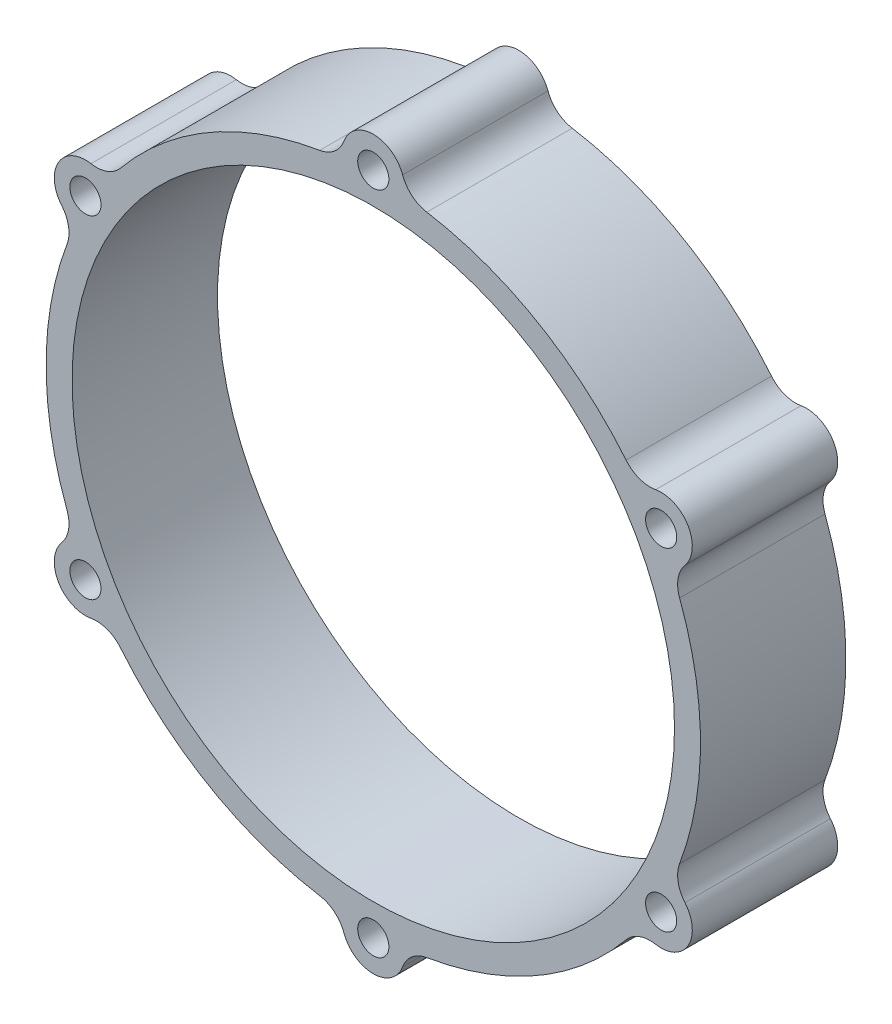
from build123d import *

# Parameters (mm, degrees)
SKETCH_1_R          = 31.5
SKETCH_1_R_2        = 29
EXTRUDE_1_DEPTH     = 14
EXTRUDE_START       = -14
EXTRUDE_2_DEPTH     = 14
SKETCH_3_R          = 1.5
CUT_EXTRUDE_1_DEPTH = 50.124840967
FILLET_1_R          = 3


with BuildPart() as part:
    # 草图1 → 凸台-拉伸1 (new body)
    with BuildSketch(Plane.XY):
        Circle(SKETCH_1_R)
        Circle(SKETCH_1_R_2, mode=Mode.SUBTRACT)
    extrude(amount=EXTRUDE_1_DEPTH)

    # 草图2 → 凸台-拉伸2 (add)
    with BuildSketch(Plane.XY.offset(14).offset(EXTRUDE_START)):
        with BuildLine():
            ThreePointArc((-28.627224802, 13.142754664), (-27.279800219, 15.75), (-25.695571815, 18.220526586))
            ThreePointArc((-25.695571815, 18.220526586), (-30.310889132, 17.5), (-28.627224802, 13.142754664))
        make_face()
        with BuildLine():
            ThreePointArc((-2.931652987, 31.36328125), (0, 31.5), (2.931652987, 31.36328125))
            ThreePointArc((2.931652987, 31.36328125), (0, 35), (-2.931652987, 31.36328125))
        make_face()
        with BuildLine():
            ThreePointArc((28.627224802, 13.142754664), (30.310889132, 17.5), (25.695571815, 18.220526586))
            ThreePointArc((25.695571815, 18.220526586), (27.279800219, 15.75), (28.627224802, 13.142754664))
        make_face()
        with BuildLine():
            ThreePointArc((25.695571815, -18.220526586), (30.310889132, -17.5), (28.627224802, -13.142754664))
            ThreePointArc((28.627224802, -13.142754664), (27.279800219, -15.75), (25.695571815, -18.220526586))
        make_face()
        with BuildLine():
            ThreePointArc((2.931652987, -31.36328125), (0, -31.5), (-2.931652987, -31.36328125))
            ThreePointArc((-2.931652987, -31.36328125), (0, -35), (2.931652987, -31.36328125))
        make_face()
        with BuildLine():
            ThreePointArc((-25.695571815, -18.220526586), (-27.279800219, -15.75), (-28.627224802, -13.142754664))
            ThreePointArc((-28.627224802, -13.142754664), (-30.310889132, -17.5), (-25.695571815, -18.220526586))
        make_face()
    extrude(amount=EXTRUDE_2_DEPTH)

    # 草图3 → 切除-拉伸1 (cut, through all)
    with BuildSketch(Plane.XY.offset(14)):
        with Locations((0, 32)):
            Circle(SKETCH_3_R)
        with Locations((-27.712812921, 16)):
            Circle(SKETCH_3_R)
        with Locations((-27.712812921, -16)):
            Circle(SKETCH_3_R)
        with Locations((0, -32)):
            Circle(SKETCH_3_R)
        with Locations((27.712812921, -16)):
            Circle(SKETCH_3_R)
        with Locations((27.712812921, 16)):
            Circle(SKETCH_3_R)
    extrude(amount=-CUT_EXTRUDE_1_DEPTH, mode=Mode.SUBTRACT)

    # 圆角1
    fillet_1_edges = [part.edges().sort_by_distance(p)[0] for p in [
        (-25.695571815, 18.220526586, 7),
        (-28.627224802, 13.142754664, 7),
        (2.931652987, 31.36328125, 7),
        (-2.931652987, 31.36328125, 7),
        (28.627224802, 13.142754664, 7),
        (25.695571815, 18.220526586, 7),
        (25.695571815, -18.220526586, 7),
        (28.627224802, -13.142754664, 7),
        (-2.931652987, -31.36328125, 7),
        (2.931652987, -31.36328125, 7),
        (-28.627224802, -13.142754664, 7),
        (-25.695571815, -18.220526586, 7),
    ]]
    fillet(fillet_1_edges, radius=FILLET_1_R)


solid = part.part
